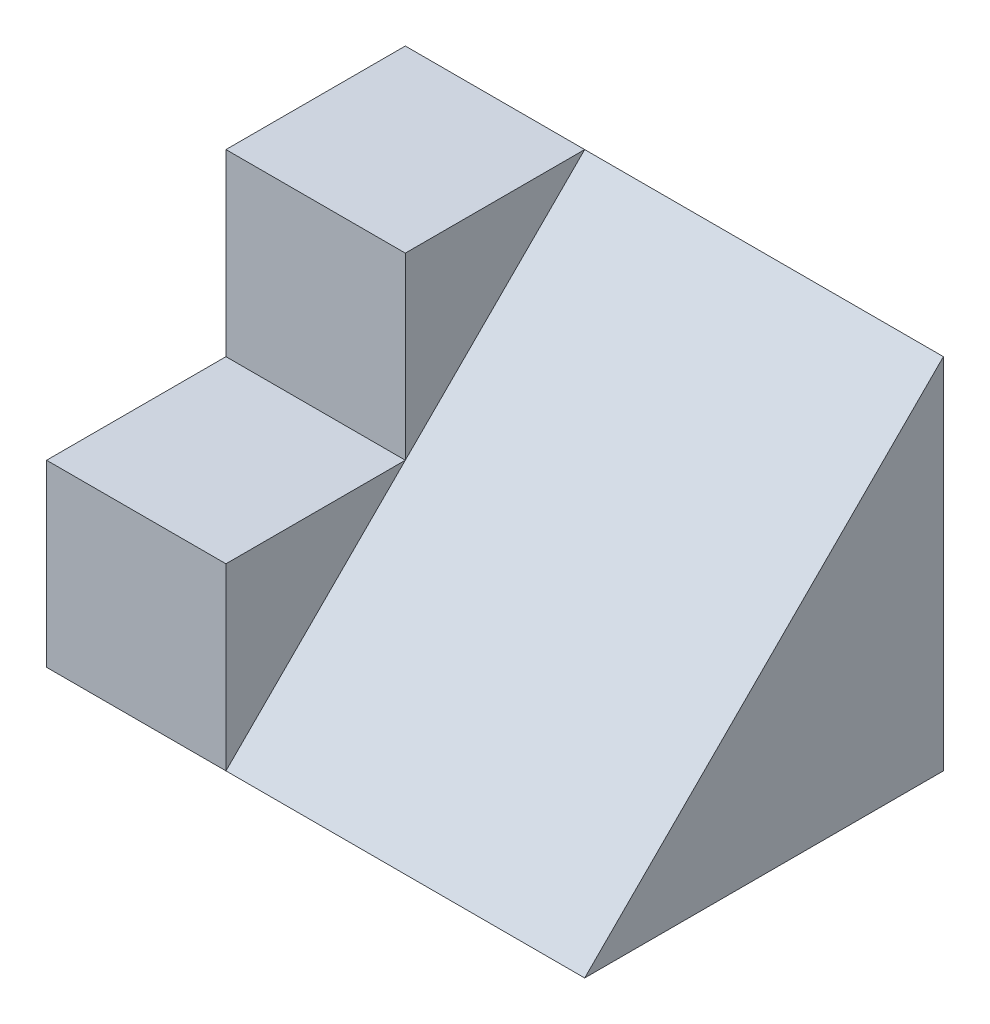
from build123d import *

# Parameters (mm, degrees)
SKETCH2_W           = 152.4
SKETCH2_H           = 101.6
BOSS_EXTRUDE1_DEPTH = 50.8
SKETCH3_W           = 50.8
SKETCH3_H           = 50.8
CUT_EXTRUDE1_DEPTH  = 50.8
CUT_EXTRUDE2_DEPTH  = 101.6


with BuildPart() as part:
    # Sketch2 → Boss-Extrude1 (new, symmetric)
    with BuildSketch(Plane.XY):
        Rectangle(SKETCH2_W, SKETCH2_H)
    extrude(amount=BOSS_EXTRUDE1_DEPTH, both=True)

    # Sketch3 → Cut-Extrude1 (cut)
    with BuildSketch(Plane(origin=(0, 50.8, 0), x_dir=(1, 0, 0), z_dir=(0, 1, 0))):
        with Locations((-50.8, -25.4)):
            Rectangle(SKETCH3_W, SKETCH3_H)
    extrude(amount=-CUT_EXTRUDE1_DEPTH, mode=Mode.SUBTRACT)

    # Sketch4 → Cut-Extrude2 (cut)
    with BuildSketch(Plane(origin=(76.2, 0, 0), x_dir=(0, 0, -1), z_dir=(1, 0, 0))):
        Polygon((-50.8, -50.8), (50.8, 50.8), (-50.8, 50.8), align=None)
    extrude(amount=-CUT_EXTRUDE2_DEPTH, mode=Mode.SUBTRACT)


solid = part.part
